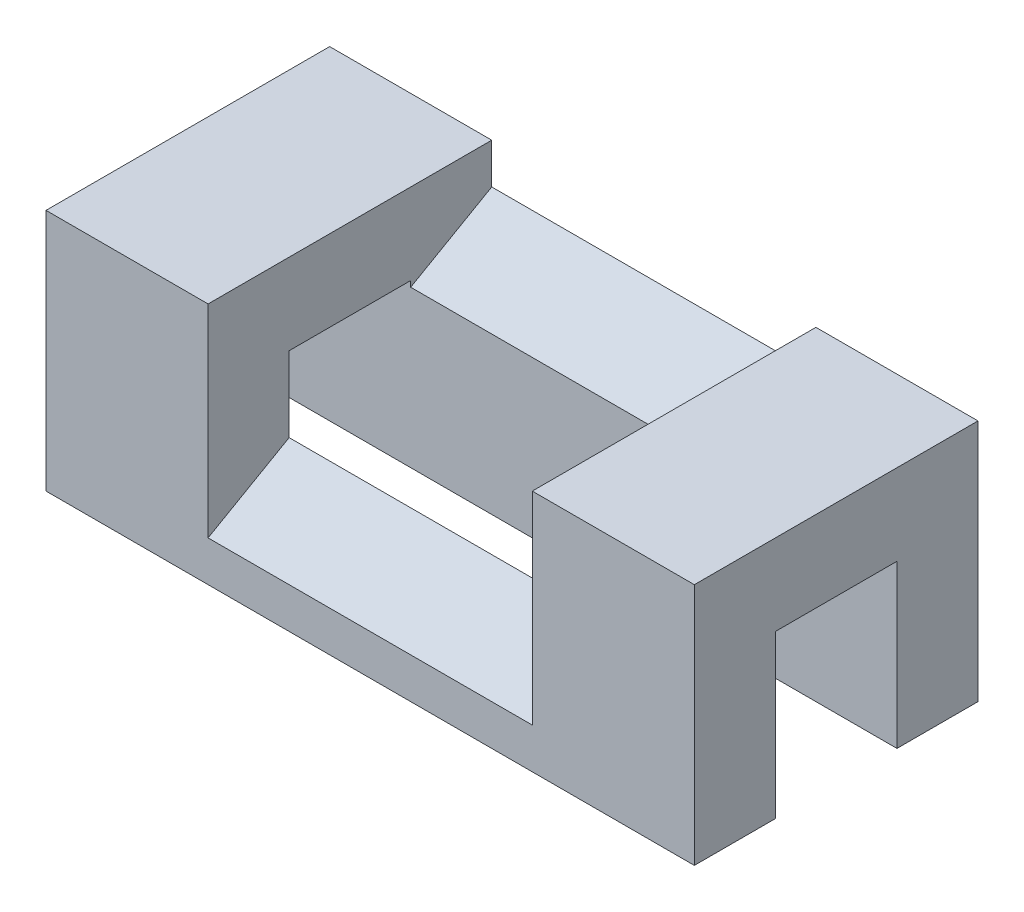
from build123d import *

# Parameters (mm, degrees)
SKETCH_1_W          = 35
SKETCH_1_H          = 30
EXTRUDE_1_DEPTH     = 40
SKETCH_3_W          = 15
SKETCH_3_H          = 20
CUT_EXTRUDE_1_DEPTH = 70
CUT_EXTRUDE_3_DEPTH = 20


with BuildPart() as part:
    # 草圖1 → 填料-伸長1 (new, symmetric)
    with BuildSketch(Plane(origin=(0, 0, 0), x_dir=(0, 0, -1), z_dir=(1, 0, 0))):
        Rectangle(SKETCH_1_W, SKETCH_1_H)
    extrude(amount=EXTRUDE_1_DEPTH, both=True)

    # 草圖3 → 除料-伸長1 (cut, symmetric)
    with BuildSketch(Plane(origin=(0, 0, 0), x_dir=(0, 0, -1), z_dir=(1, 0, 0))):
        with Locations((0, -5)):
            Rectangle(SKETCH_3_W, SKETCH_3_H)
    extrude(amount=CUT_EXTRUDE_1_DEPTH, both=True, mode=Mode.SUBTRACT)

    # 草圖5 → 除料-伸長3 (cut, symmetric)
    with BuildSketch(Plane(origin=(0, 0, 0), x_dir=(0, 0, -1), z_dir=(1, 0, 0))):
        Polygon((7.5, 4.285714286), (17.5, 10), (17.5, 15), (-17.5, 15), (-17.5, -10), (-7.5, -4.285714286), (-7.5, 5), (7.5, 5), align=None)
    extrude(amount=CUT_EXTRUDE_3_DEPTH, both=True, mode=Mode.SUBTRACT)


solid = part.part
